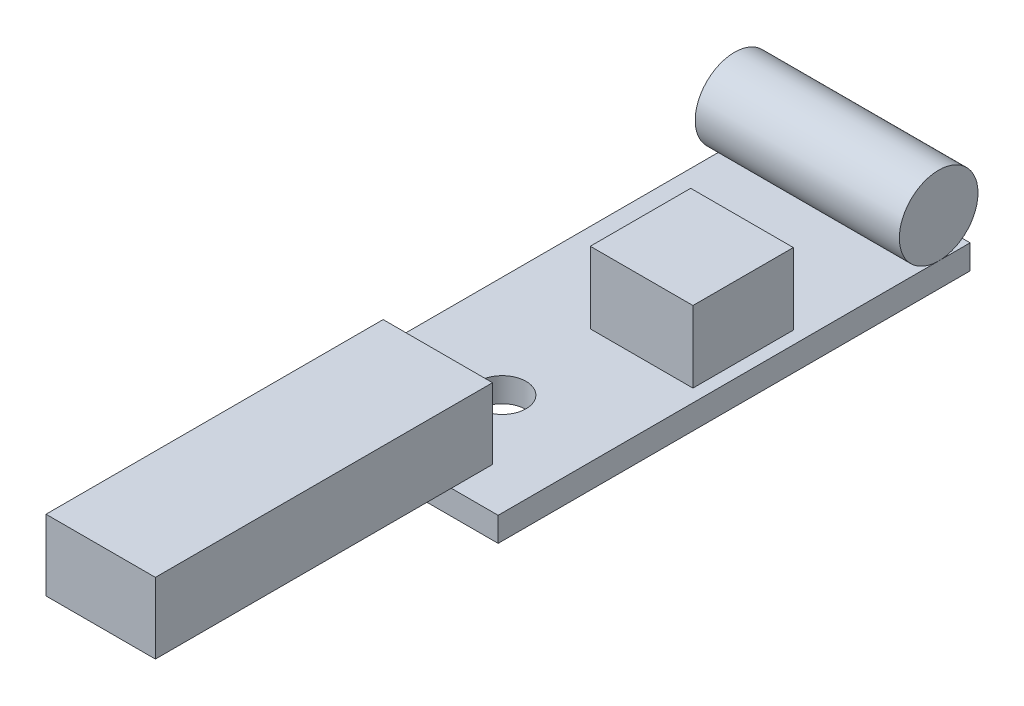
from build123d import *

# Parameters (mm, degrees)
SKETCH1_W           = 13.843
SKETCH1_H           = 32.004
SKETCH1_R           = 1.6129
BOSS_EXTRUDE1_DEPTH = 1.651
SKETCH2_R           = 2.667
BOSS_EXTRUDE2_DEPTH = 13.843
SKETCH3_W           = 6.9596
SKETCH3_H           = 6.8072
BOSS_EXTRUDE3_DEPTH = 4.8514
SKETCH4_W           = 7.4168
SKETCH4_H           = 22.86
BOSS_EXTRUDE4_DEPTH = 4.8006


with BuildPart() as part:
    # Sketch1 → Boss-Extrude1 (new body)
    with BuildSketch(Plane(origin=(0, 0, 0), x_dir=(1, 0, 0), z_dir=(0, 1, 0))):
        Rectangle(SKETCH1_W, SKETCH1_H)
        with Locations(Location((0, -8.8011, 0), (0, 0, 90))):
            Circle(SKETCH1_R, mode=Mode.SUBTRACT)
    extrude(amount=BOSS_EXTRUDE1_DEPTH)

    # Sketch3 → Boss-Extrude3 (add)
    with BuildSketch(Plane(origin=(0, 1.651, 0), x_dir=(1, 0, 0), z_dir=(0, 1, 0))):
        with Locations((2.5781, 1.4732)):
            Rectangle(SKETCH3_W, SKETCH3_H)
    extrude(amount=BOSS_EXTRUDE3_DEPTH)

    # Sketch4 → Boss-Extrude4 (add)
    with BuildSketch(Plane(origin=(0, 1.651, 0), x_dir=(1, 0, 0), z_dir=(0, 1, 0))):
        with Locations((0.0381, -24.638)):
            Rectangle(SKETCH4_W, SKETCH4_H)
    extrude(amount=BOSS_EXTRUDE4_DEPTH)


with BuildPart() as body_2:
    # Sketch2 → Boss-Extrude2 (new body)
    with BuildSketch(Plane(origin=(6.9215, 0, 0), x_dir=(0, 0, -1), z_dir=(1, 0, 0))):
        with Locations((13.8684, 4.318)):
            Circle(SKETCH2_R)
    extrude(amount=-BOSS_EXTRUDE2_DEPTH)


solid = Compound([part.part, body_2.part])
